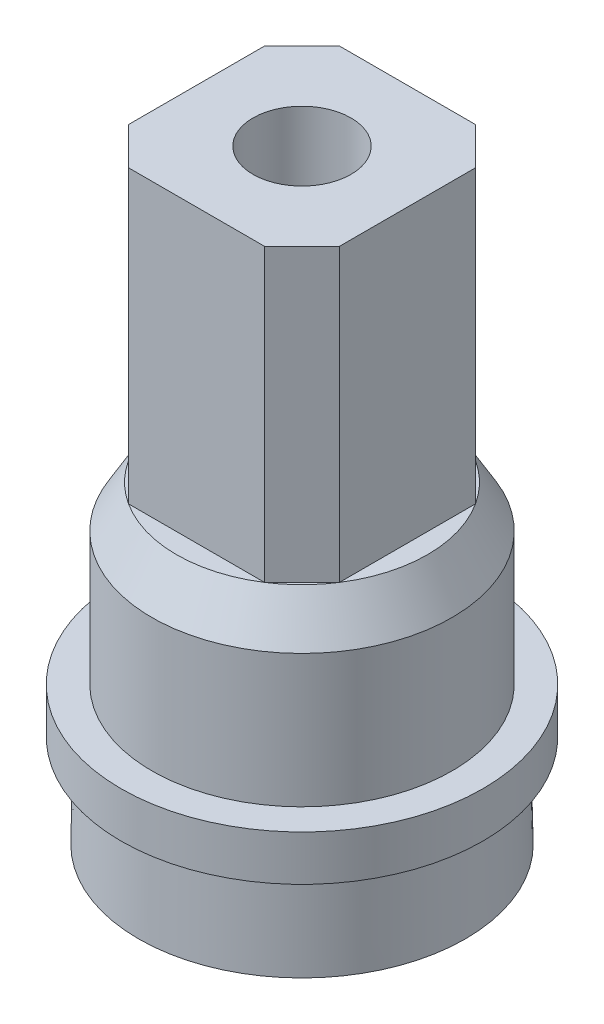
from build123d import *

# Parameters (mm, degrees)
BOSS_EXTRUDE1_START = 7.7
SKETCH2_R           = 1.295
BOSS_EXTRUDE1_DEPTH = 7.7


with BuildPart() as part:
    # Sketch1 → Revolve1 (revolve)
    with BuildSketch(Plane.XY, mode=Mode.PRIVATE) as revolve1_sk:
        Polygon((-2.7, 0), (-2.7, 5.54), (-1.295, 5.54), (-1.295, 8.3), (-3.32, 8.3), (-3.97, 7.184383121), (-3.97, 3.67), (-4.785, 3.67), (-4.785, 2.47), (-4.28, 2.47), (-4.325, 0), align=None)
    revolve(revolve1_sk.sketch.rotate(Axis((0, 0, 0), (0, 1, 0)), 270), axis=Axis((0, 0, 0), (0, 1, 0)))

    # Sketch2 → Boss-Extrude1 (add)
    with BuildSketch(Plane(origin=(0, 8.3, 0), x_dir=(1, 0, 0), z_dir=(0, 1, 0)).offset(BOSS_EXTRUDE1_START)):
        Polygon((1.799527716, 2.79), (-1.799527716, 2.79), (-2.79, 1.799527716), (-2.79, -1.799527716), (-1.799527716, -2.79), (1.799527716, -2.79), (2.79, -1.799527716), (2.79, 1.799527716), align=None)
        with Locations(Location((0, 0, 0), (0, 0, 90))):
            Circle(SKETCH2_R, mode=Mode.SUBTRACT)
    extrude(amount=-BOSS_EXTRUDE1_DEPTH)


solid = part.part
